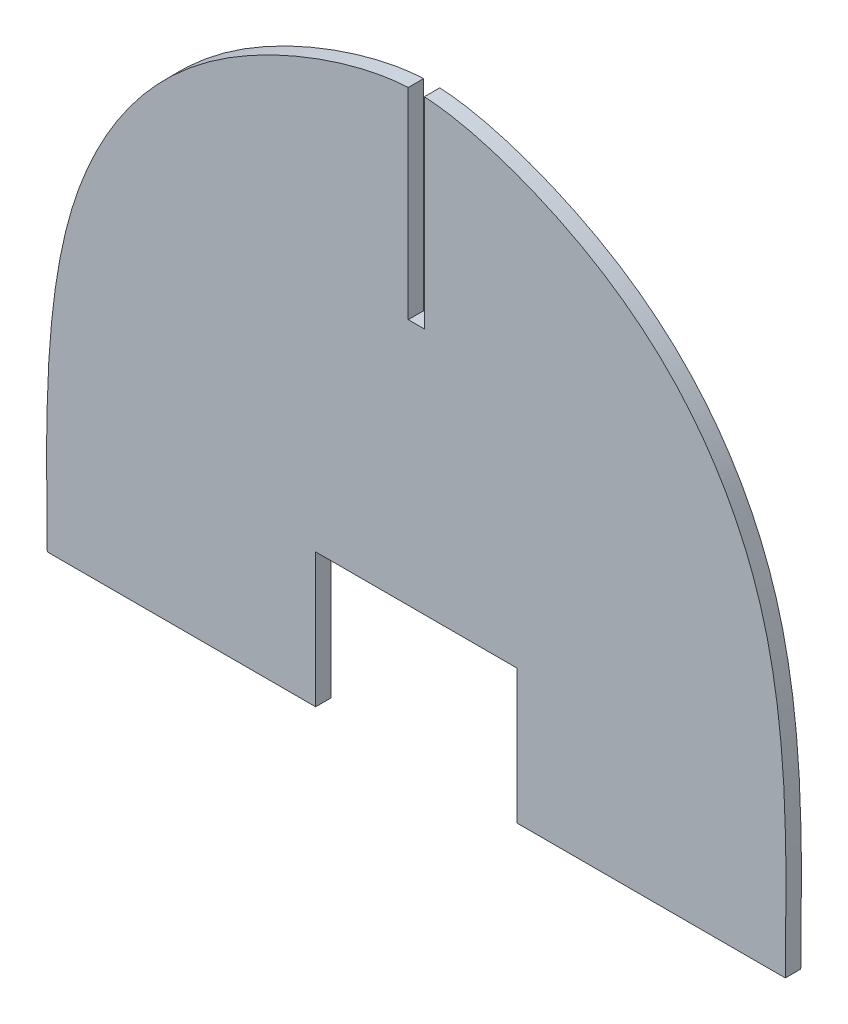
from build123d import *

# Parameters (mm, degrees)
BOSS_EXTRUDE1_DEPTH = 5.842
SKETCH3_W           = 38.1
SKETCH3_H           = 50.8
SKETCH3_W_2         = 3.048
SKETCH3_H_2         = 76.2
CUT_EXTRUDE1_DEPTH  = 296.629932067


with BuildPart() as part:
    # Sketch2 → Boss-Extrude1 (new body)
    with BuildSketch(Plane.XY):
        with BuildLine():
            Line((0, 260.35), (0, 39.6875))
            Line((0, 39.6875), (139.7, 39.6875))
            add(Edge.make_bspline(
                [(0, 260.35), (16.070876529, 260.35), (56.775834588, 247.639527653), (104.303414455, 213.336844908), (143.628247025, 143.243818772), (139.7, 69.950012947), (139.7, 39.6875)],
                knots=[0, 0, 0, 0, 0.196513492, 0.377404691, 0.603721219, 1, 1, 1, 1], degree=3))
        make_face()
    extrude(amount=BOSS_EXTRUDE1_DEPTH)

    # Sketch3 → Cut-Extrude1 (cut, through all)
    with BuildSketch(Plane.XY.offset(5.842)):
        with Locations((19.05, 65.0875)):
            Rectangle(SKETCH3_W, SKETCH3_H)
        with Locations((1.524, 222.25)):
            Rectangle(SKETCH3_W_2, SKETCH3_H_2)
    extrude(amount=-CUT_EXTRUDE1_DEPTH, mode=Mode.SUBTRACT)

    # Mirror1: part across plane


with BuildPart() as part_1:
    add(part.part)
    add(part.part.mirror(Plane(origin=(0, 0, 0), x_dir=(0, 0, 1), z_dir=(1, 0, 0))))


solid = part_1.part
